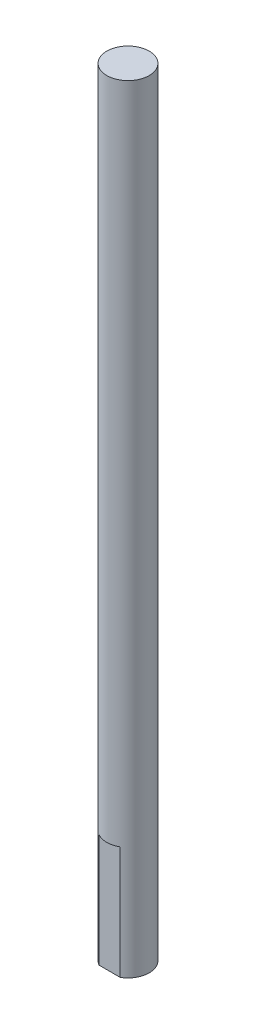
from build123d import *

# Parameters (mm, degrees)
SKETCH1_R           = 1.5
BOSS_EXTRUDE1_DEPTH = 55
CUT_EXTRUDE1_DEPTH  = 8


with BuildPart() as part:
    # Sketch1 → Boss-Extrude1 (new body)
    with BuildSketch(Plane(origin=(0, 0, 0), x_dir=(1, 0, 0), z_dir=(0, 1, 0))):
        with Locations(Location((0, 0, 0), (0, 0, 270))):
            Circle(SKETCH1_R)
    extrude(amount=BOSS_EXTRUDE1_DEPTH)

    # Sketch2 → Cut-Extrude1 (cut)
    with BuildSketch(Plane.XZ):
        with BuildLine():
            Line((-0.748331477, 1.3), (0.748331477, 1.3))
            ThreePointArc((0.748331477, 1.3), (0, 1.5), (-0.748331477, 1.3))
        make_face()
    extrude(amount=-CUT_EXTRUDE1_DEPTH, mode=Mode.SUBTRACT)


solid = part.part
